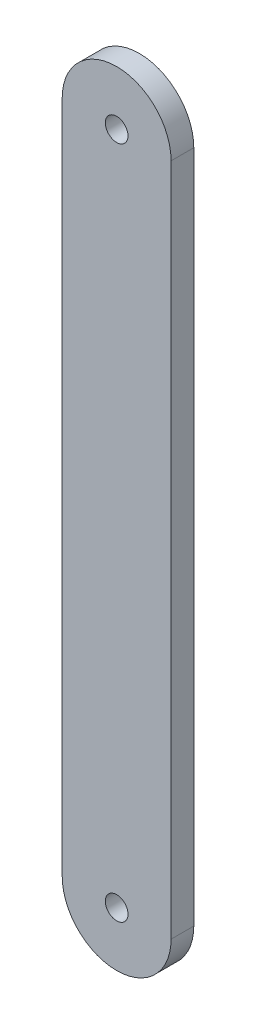
from build123d import *

# Parameters (mm, degrees)
SKETCH_1_R      = 2.5
EXTRUDE_1_DEPTH = 5


with BuildPart() as part:
    # 草图1 → 凸台-拉伸1 (new body)
    with BuildSketch(Plane.XY.offset(5)):
        with BuildLine():
            Line((12, -74.28), (12, 74.28))
            ThreePointArc((12, 74.28), (0, 86.28), (-12, 74.28))
            Line((-12, 74.28), (-12, -74.28))
            ThreePointArc((-12, -74.28), (0, -86.28), (12, -74.28))
        make_face()
        with Locations(Location((0, -74.28, 0), (0, 0, 180))):
            Circle(SKETCH_1_R, mode=Mode.SUBTRACT)
        with Locations(Location((0, 74.28, 0), (0, 0, 180))):
            Circle(SKETCH_1_R, mode=Mode.SUBTRACT)
    extrude(amount=-EXTRUDE_1_DEPTH)


solid = part.part
